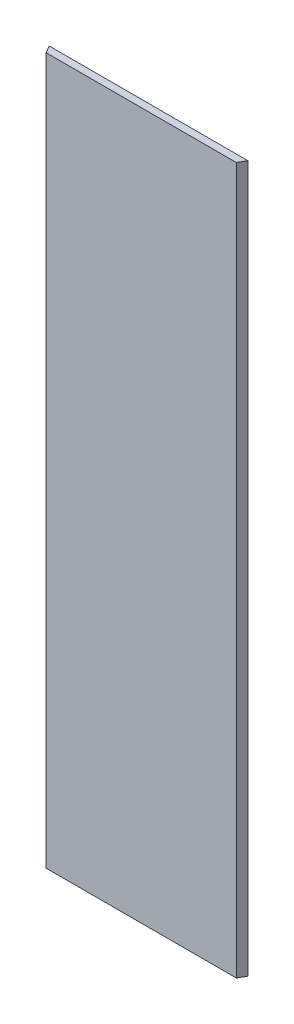
from build123d import *

# Parameters (mm, degrees)
SKETCH1_W           = 171.45
SKETCH1_H           = 609.6
BOSS_EXTRUDE1_DEPTH = 6.35
CUT_EXTRUDE1_DEPTH  = 616.630780684


with BuildPart() as part:
    # Sketch1 → Boss-Extrude1 (new body)
    with BuildSketch(Plane.XY):
        Rectangle(SKETCH1_W, SKETCH1_H)
    extrude(amount=BOSS_EXTRUDE1_DEPTH)

    # Sketch3 → Cut-Extrude1 (cut, through all)
    with BuildSketch(Plane(origin=(0, 304.8, 0), x_dir=(1, 0, 0), z_dir=(0, 1, 0))):
        Polygon((-85.725, 0), (-85.725, -6.35), (-82.058825791, -6.35), align=None)
        Polygon((82.058825791, -6.35), (85.725, 0), (85.725, -6.35), align=None)
    extrude(amount=-CUT_EXTRUDE1_DEPTH, mode=Mode.SUBTRACT)


solid = part.part
